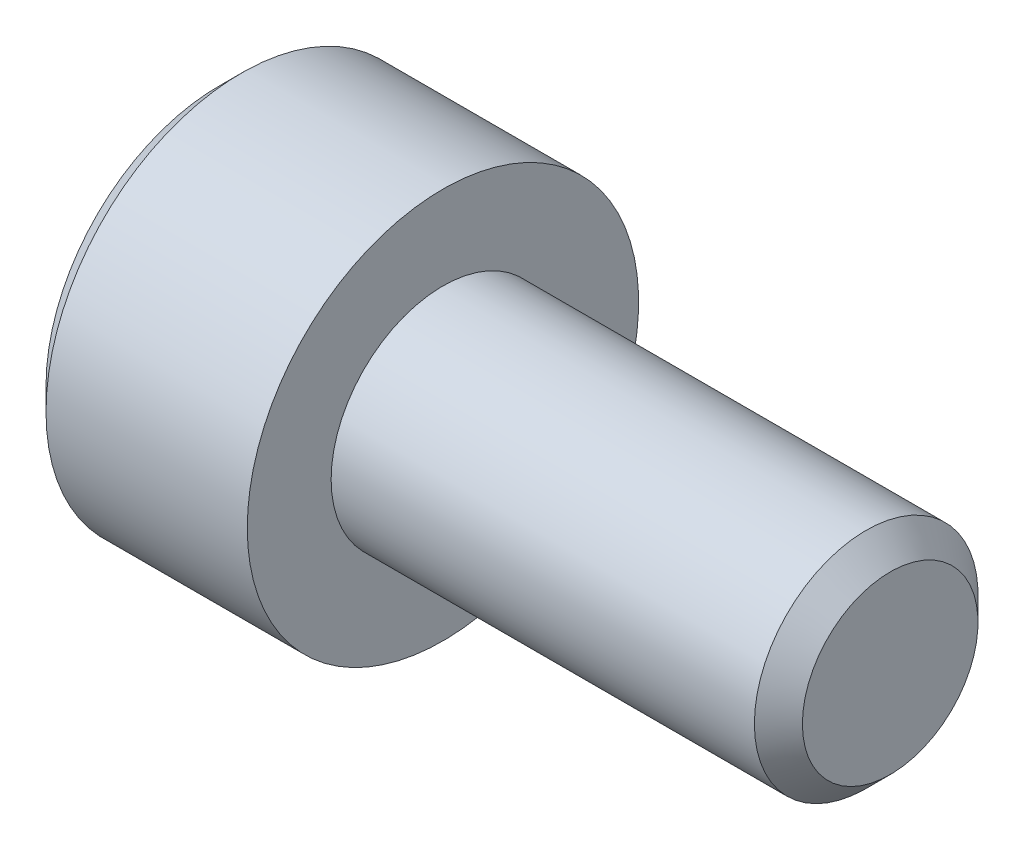
from build123d import *

# Parameters (mm, degrees)
CUT_EXTRUDE1_DEPTH = 2


with BuildPart() as part:
    # Sketch1 → Revolve1 (revolve)
    with BuildSketch(Plane.XY):
        Polygon((-4, 0), (8, 0), (8, -1.5705), (7.5705, -2), (0, -2), (0, -3.5), (-3.6, -3.5), (-4, -3.1), align=None)
    revolve(axis=Axis((-4.6, 0, 0), (1, 0, 0)))

    # Sketch2 → Cut-Extrude1 (cut)
    with BuildSketch(Plane.ZY.offset(4)):
        Polygon((0, 1.732050808), (-1.5, 0.866025404), (-1.5, -0.866025404), (0, -1.732050808), (1.5, -0.866025404), (1.5, 0.866025404), align=None)
    extrude(amount=-CUT_EXTRUDE1_DEPTH, mode=Mode.SUBTRACT)


solid = part.part
